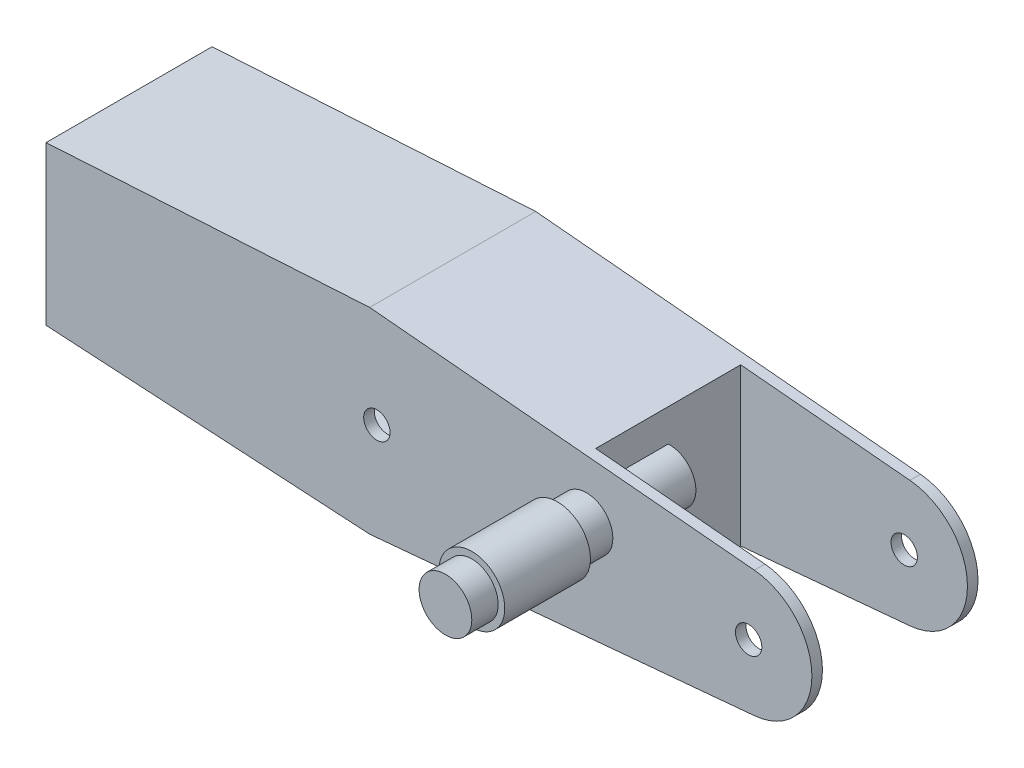
from build123d import *

# Parameters (mm, degrees)
EXTRUSION1_DEPTH             = 126
ESQUISSE2_W                  = 110
ESQUISSE2_H                  = 140
ENL_V_MAT_EXTRU_1_DEPTH      = 200
ENL_V_MAT_EXTRU_2_DEPTH      = 55
ENL_V_MAT_EXTRU_2_DEPTH_BACK = 55
ESQUISSE6_OUTSIDE_W          = 705.578
ESQUISSE6_OUTSIDE_H          = 273.578
ESQUISSE8_R                  = 20
EXTRUSION2_DEPTH             = 85
ESQUISSE9_R                  = 25
EXTRUSION3_DEPTH             = 65
ESQUISSE10_R                 = 20
EXTRUSION4_DEPTH             = 20
ESQUISSE11_R                 = 10
ENL_V_MAT_EXTRU_3_DEPTH      = 362.007271395
ESQUISSE12_R                 = 10
ENL_V_MAT_EXTRU_4_DEPTH      = 362.007271395


with BuildPart() as part:
    # Esquisse1 → Extrusion1 (new body)
    with BuildSketch(Plane.XY):
        with BuildLine():
            Line((-251, 60), (-251, -60))
            Line((-251, -60), (-5.478634649, -74.5))
            Line((-5.478634649, -74.5), (286.372947888, -47.800390446))
            ThreePointArc((286.372947888, -47.800390446), (330, 0), (286.372947888, 47.800390446))
            Line((286.372947888, 47.800390446), (-5.478634649, 74.5))
            Line((-5.478634649, 74.5), (-251, 60))
        make_face()
    extrude(amount=EXTRUSION1_DEPTH)

    # Esquisse2 → Enlèv. mat.-Extru.1 (cut)
    with BuildSketch(Plane(origin=(158, 0, 0), x_dir=(0, 0, -1), z_dir=(1, 0, 0))):
        with Locations((-63, -30)):
            Rectangle(ESQUISSE2_W, ESQUISSE2_H)
    extrude(amount=ENL_V_MAT_EXTRU_1_DEPTH, mode=Mode.SUBTRACT)

    # Esquisse6 outside → Enlèv. mat.-Extru.2 (cut, two sides: drawn at the far end of the back side and taken through both)
    # profile 1 of 2: a face of its own
    with BuildSketch(Plane.XY.offset(63).offset(-ENL_V_MAT_EXTRU_2_DEPTH_BACK)):
        with Locations((39.5, 0)):
            Rectangle(ESQUISSE6_OUTSIDE_W, ESQUISSE6_OUTSIDE_H)
        Polygon((-251, 60), (-251, -60), (-5.478634649, -74.5), (158, -59.544399357), (158, 59.544399357), (-5.478634649, 74.5), align=None, mode=Mode.SUBTRACT)
    # profile 2 of 2: a face of its own
    with BuildSketch(Plane.XY.offset(63).offset(-ENL_V_MAT_EXTRU_2_DEPTH_BACK)):
        Polygon((152, 54.068245078), (152, -54.068245078), (-5.575624206, -68.483817558), (-245, -54.343893548), (-245, 54.343893548), (-5.575624206, 68.483817558), align=None)
    extrude(amount=ENL_V_MAT_EXTRU_2_DEPTH + ENL_V_MAT_EXTRU_2_DEPTH_BACK, mode=Mode.SUBTRACT)

    # Esquisse8 → Extrusion2 (add)
    with BuildSketch(Plane.XY.offset(63)):
        with Locations((159, 15)):
            Circle(ESQUISSE8_R)
    extrude(amount=EXTRUSION2_DEPTH)

    # Esquisse9 → Extrusion3 (add)
    with BuildSketch(Plane.XY.offset(148)):
        with Locations((159, 15)):
            Circle(ESQUISSE9_R)
    extrude(amount=EXTRUSION3_DEPTH)

    # Esquisse10 → Extrusion4 (add)
    with BuildSketch(Plane.XY.offset(213)):
        with Locations((159, 15)):
            Circle(ESQUISSE10_R)
    extrude(amount=EXTRUSION4_DEPTH)

    # Esquisse11 → Enlèv. mat.-Extru.3 (cut, through all)
    with BuildSketch(Plane.XY.offset(126)):
        with Locations((282, 0)):
            Circle(ESQUISSE11_R)
    extrude(amount=-ENL_V_MAT_EXTRU_3_DEPTH, mode=Mode.SUBTRACT)

    # Esquisse12 → Enlèv. mat.-Extru.4 (cut, through all)
    with BuildSketch(Plane.XY.offset(126)):
        Circle(ESQUISSE12_R)
    extrude(amount=-ENL_V_MAT_EXTRU_4_DEPTH, mode=Mode.SUBTRACT)


solid = part.part
